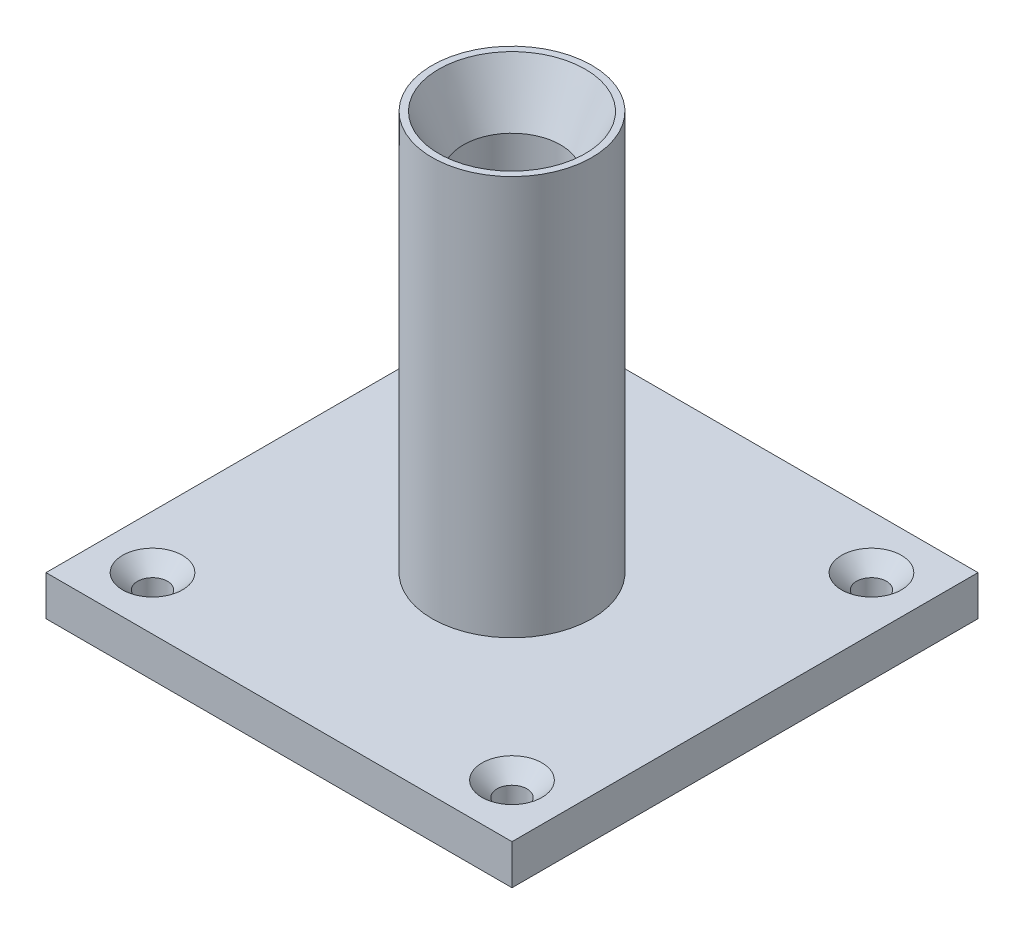
from build123d import *

# Parameters (mm, degrees)
CROQUIS1_W              = 70
CROQUIS1_H              = 70
SALIENTE_EXTRUIR1_DEPTH = 6
SALIENTE_EXTRUIR2_DEPTH = 52
CROQUIS4_R              = 2.25
CORTAR_EXTRUIR1_DEPTH   = 83.498484835
CHAFL_N1_SIZE           = 2.25


with BuildPart() as part:
    # Croquis1 → Saliente-Extruir1 (new body)
    with BuildSketch(Plane(origin=(0, 0, 0), x_dir=(1, 0, 0), z_dir=(0, 1, 0))):
        Rectangle(CROQUIS1_W, CROQUIS1_H)
    extrude(amount=SALIENTE_EXTRUIR1_DEPTH)

    # Croquis2 → Revolución1 (revolve)
    with BuildSketch(Plane.XY, mode=Mode.PRIVATE) as revoluci_n1_sk:
        Polygon((7.3, 6), (12, 6), (12, 66), (11, 66), (7.3, 58), align=None)
    revolve(revoluci_n1_sk.sketch.rotate(Axis((0, 0, 0), (0, 1, 0)), 90), axis=Axis((0, 0, 0), (0, 1, 0)))

    # Croquis3 → Saliente-Extruir2 (add)
    with BuildSketch(Plane(origin=(0, 6, 0), x_dir=(1, 0, 0), z_dir=(0, 1, 0))):
        with BuildLine():
            Line((6.3, -3.687817783), (6.3, 3.687817783))
            ThreePointArc((6.3, 3.687817783), (7.3, 0), (6.3, -3.687817783))
        make_face()
    extrude(amount=SALIENTE_EXTRUIR2_DEPTH)

    # Croquis4 → Cortar-Extruir1 (cut, through all)
    with BuildSketch(Plane(origin=(0, 0, 0), x_dir=(1, 0, 0), z_dir=(0, 1, 0))):
        with Locations(Location((27, 27, 0), (0, 0, 270))):
            Circle(CROQUIS4_R)
        with Locations(Location((27, -27, 0), (0, 0, 270))):
            Circle(CROQUIS4_R)
        with Locations(Location((-27, 27, 0), (0, 0, 270))):
            Circle(CROQUIS4_R)
        with Locations(Location((-27, -27, 0), (0, 0, 270))):
            Circle(CROQUIS4_R)
    extrude(amount=CORTAR_EXTRUIR1_DEPTH, mode=Mode.SUBTRACT)

    # Chaflán1
    chafl_n1_edges = [part.edges().sort_by_distance(p)[0] for p in [
        (27, 6, 24.75),
        (-27, 6, -29.25),
        (-27, 6, 24.75),
        (27, 6, -29.25),
    ]]
    chamfer(chafl_n1_edges, length=CHAFL_N1_SIZE)


solid = part.part
